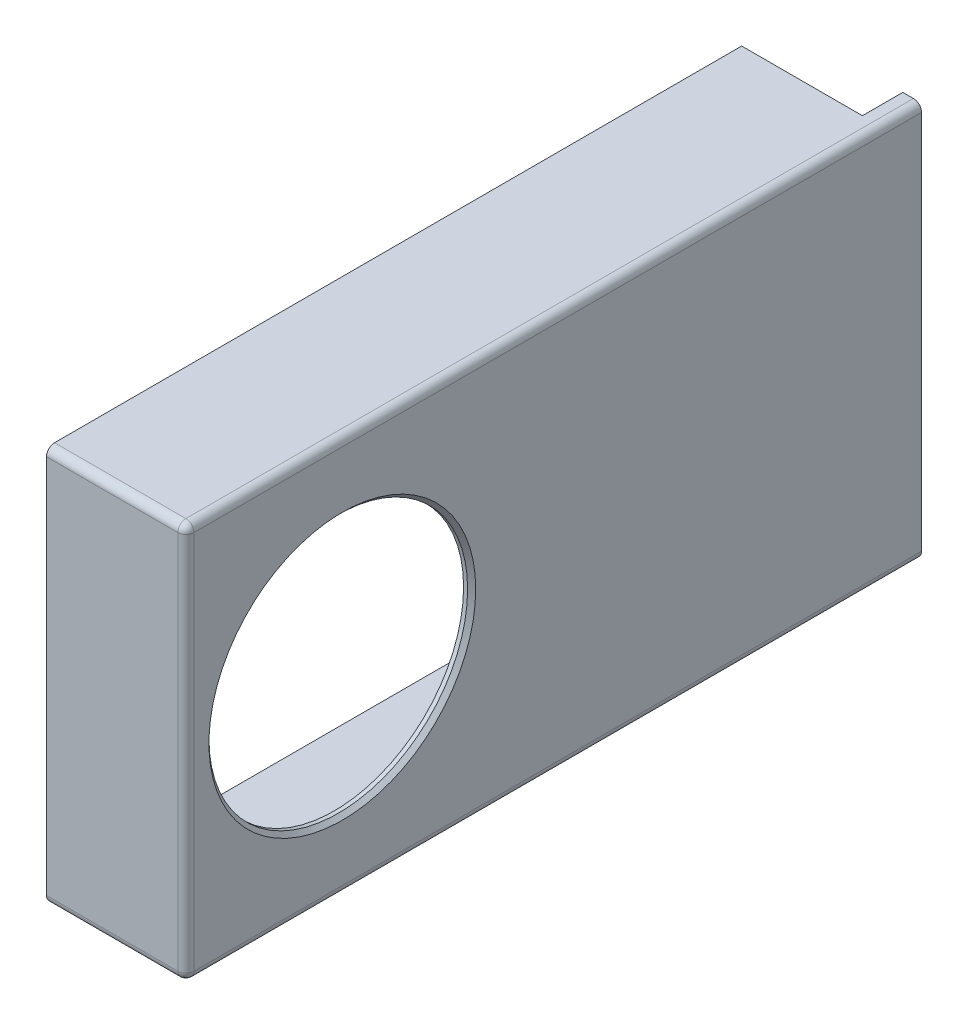
from build123d import *

# Parameters (mm, degrees)
SKETCH_1_W          = 182
SKETCH_1_H          = 98
EXTRUDE_1_DEPTH     = 34.5
SHELL_1_T           = -2
SKETCH_2_R          = 32
CUT_EXTRUDE_1_DEPTH = 10
SKETCH_3_W          = 29.866450527
SKETCH_3_H          = 86.675289488
CUT_EXTRUDE_2_DEPTH = 10
FILLET_1_R          = 2
SKETCH_4_W          = 15
SKETCH_4_H          = 22
CUT_EXTRUDE_3_DEPTH = 10
FILLET_2_R          = 1
CHAMFER_1_SIZE      = 1


with BuildPart() as part:
    # 草图1 → 凸台-拉伸1 (new body)
    with BuildSketch(Plane(origin=(0, 0, 0), x_dir=(0, 0, -1), z_dir=(1, 0, 0))):
        with Locations((91, -49)):
            Rectangle(SKETCH_1_W, SKETCH_1_H)
    extrude(amount=EXTRUDE_1_DEPTH)

    # 抽壳1
    shell_1_openings = [part.faces().sort_by_distance(p)[0] for p in [
        (0, -49, -91),
    ]]
    offset(amount=SHELL_1_T, openings=shell_1_openings, kind=Kind.INTERSECTION)

    # 草图2 → 切除-拉伸1 (cut)
    with BuildSketch(Plane(origin=(34.5, 0, 0), x_dir=(0, 0, -1), z_dir=(1, 0, 0))):
        with Locations((38.698604665, -49)):
            Circle(SKETCH_2_R)
    extrude(amount=-CUT_EXTRUDE_1_DEPTH, mode=Mode.SUBTRACT)

    # 草图3 → 切除-拉伸2 (cut)
    with BuildSketch(Plane(origin=(0, 0, -182), x_dir=(-1, 0, 0), z_dir=(0, 0, -1))):
        with Locations((-14.933225264, -43.337644744)):
            Rectangle(SKETCH_3_W, SKETCH_3_H)
    extrude(amount=-CUT_EXTRUDE_2_DEPTH, mode=Mode.SUBTRACT)

    # 圆角1
    fillet_1_edges = [part.edges().sort_by_distance(p)[0] for p in [
        (34.5, 0, -91),
        (34.5, -49, 0),
        (17.25, 0, 0),
        (17.25, -98, 0),
        (34.5, -98, -91),
    ]]
    fillet(fillet_1_edges, radius=FILLET_1_R)

    # 草图4 → 切除-拉伸3 (cut)
    with BuildSketch(Plane(origin=(0, -98, 0), x_dir=(-1, 0, 0), z_dir=(0, -1, 0))):
        with Locations((-7.5, 21)):
            Rectangle(SKETCH_4_W, SKETCH_4_H)
    extrude(amount=-CUT_EXTRUDE_3_DEPTH, mode=Mode.SUBTRACT)

    # 圆角2
    fillet_2_edges = [part.edges().sort_by_distance(p)[0] for p in [
        (15, -97, -10),
        (15, -97, -32),
    ]]
    fillet(fillet_2_edges, radius=FILLET_2_R)

    # 倒角1
    chamfer_1_edges = [part.edges().sort_by_distance(p)[0] for p in [
        (34.5, -49, -6.698604665),
    ]]
    chamfer(chamfer_1_edges, length=CHAMFER_1_SIZE)


solid = part.part
